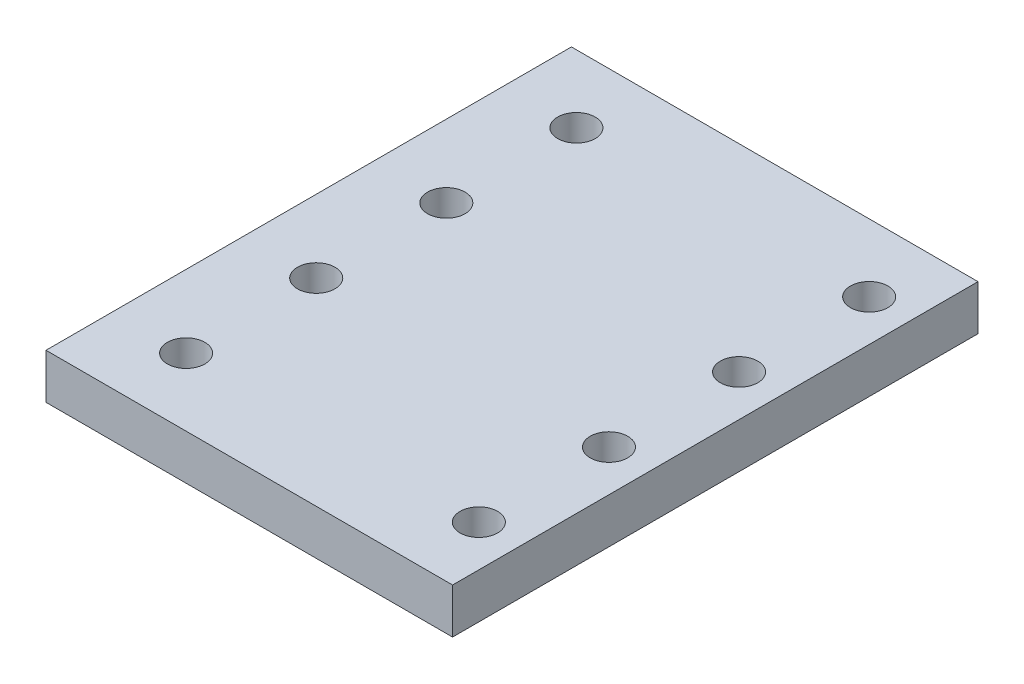
from build123d import *

# Parameters (mm, degrees)
SKETCH_1_W      = 32.5
SKETCH_1_H      = 42
SKETCH_1_R      = 1.5
EXTRUDE_1_DEPTH = 3.606514


with BuildPart() as part:
    # Эскиз1 → Бобышка-Вытянуть1 (new body)
    with BuildSketch(Plane(origin=(0, 0, 0), x_dir=(1, 0, 0), z_dir=(0, 1, 0))):
        with Locations((-0.043139262, -0.862785246)):
            Rectangle(SKETCH_1_W, SKETCH_1_H)
        with Locations(Location((12.906860738, 14.737214754, 0), (0, 0, 270))):
            Circle(SKETCH_1_R, mode=Mode.SUBTRACT)
        with Locations(Location((12.906860738, 4.337214754, 0), (0, 0, 270))):
            Circle(SKETCH_1_R, mode=Mode.SUBTRACT)
        with Locations(Location((12.906860738, -6.062785246, 0), (0, 0, 270))):
            Circle(SKETCH_1_R, mode=Mode.SUBTRACT)
        with Locations(Location((12.906860738, -16.462785246, 0), (0, 0, 270))):
            Circle(SKETCH_1_R, mode=Mode.SUBTRACT)
        with Locations(Location((-10.493139262, 14.737214754, 0), (0, 0, 270))):
            Circle(SKETCH_1_R, mode=Mode.SUBTRACT)
        with Locations(Location((-10.493139262, 4.337214754, 0), (0, 0, 270))):
            Circle(SKETCH_1_R, mode=Mode.SUBTRACT)
        with Locations(Location((-10.493139262, -16.462785246, 0), (0, 0, 270))):
            Circle(SKETCH_1_R, mode=Mode.SUBTRACT)
        with Locations(Location((-10.493139262, -6.062785246, 0), (0, 0, 270))):
            Circle(SKETCH_1_R, mode=Mode.SUBTRACT)
    extrude(amount=EXTRUDE_1_DEPTH)


solid = part.part
